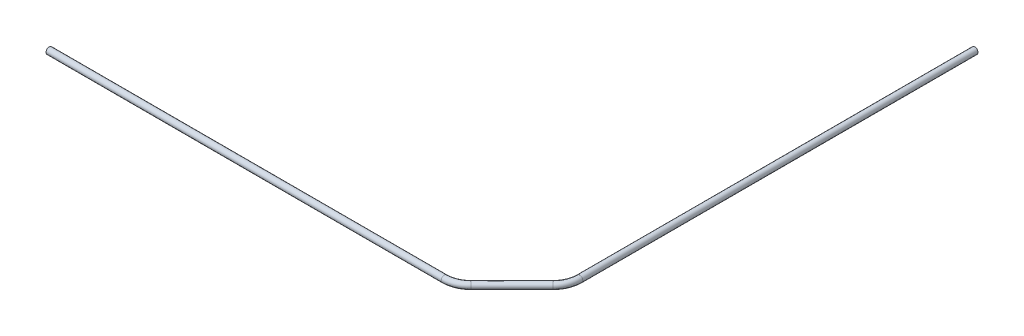
from build123d import *

# Parameters (mm, degrees)
SKETCH_2_R = 6


with BuildPart() as part:
    # По траектории1: sweep along a path in Эскиз1
    with BuildLine(Plane(origin=(0, 0, 0), x_dir=(1, 0, 0), z_dir=(0, 1, 0))) as sweep_1_path:
        Line((-850, -18), (-108.776695297, -18))
        ThreePointArc((-108.776695297, -18), (-89.642523678, -14.193976626), (-73.421356237, -3.355339059))
        Line((-73.421356237, -3.355339059), (3.355339059, 73.421356237))
        ThreePointArc((3.355339059, 73.421356237), (14.193976626, 89.642523678), (18, 108.776695297))
        Line((18, 108.776695297), (18, 850))
    # Эскиз2 → По траектории1 (sweep)
    with BuildSketch(Plane(origin=(-850, 0, 18), x_dir=(0, 0, -1), z_dir=(1, 0, 0))):
        Circle(SKETCH_2_R)
    sweep(path=sweep_1_path.line)


solid = part.part
